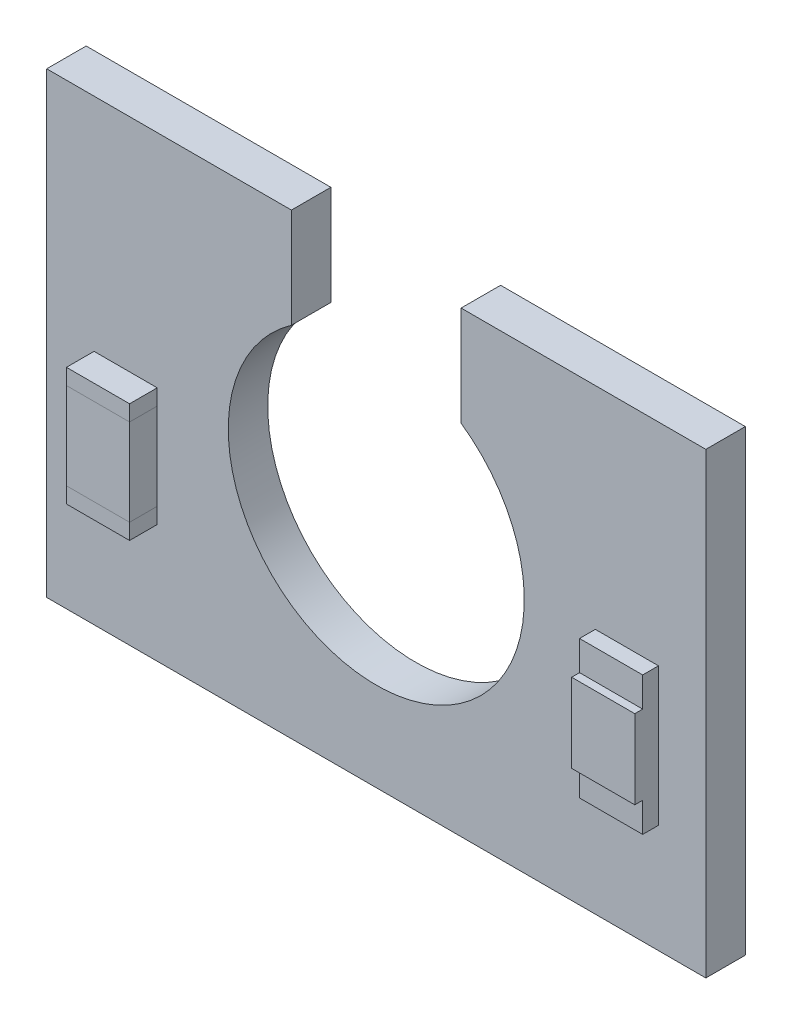
from build123d import *

# Parameters (mm, degrees)
BASES_W                           = 16.7
BASES_H                           = 11.6
BASE_DEPTH                        = 1
FASTENER_ACCESS_DEPTH             = 11.215796592
SMDCAPACITORBODYS_W               = 1.6
SMDCAPACITORBODYS_H               = 2.2
SMD_CAPACITOR_BODY_DEPTH          = 0.7
SMDCAPACITORSOLDERBODY1S_W        = 1.6
SMDCAPACITORSOLDERBODY1S_H        = 0.7
SMD_CAPACITOR_SOLDER_BODY_1_DEPTH = 0.4
SMDCAPACITORSOLDERBODY2S_W        = 1.6
SMDCAPACITORSOLDERBODY2S_H        = 0.7
SMD_CAPACITOR_SOLDER_BODY_2_DEPTH = 0.4
LEDS_W                            = 1.6
LEDS_H                            = 3.5
LED_DEPTH                         = 0.4
LEDTS_W                           = 1.6
LEDTS_H                           = 2
LED_TOP_DEPTH                     = 0.2


with BuildPart() as part:
    # BaseS → BASE (new body)
    with BuildSketch(Plane.XY):
        Rectangle(BASES_W, BASES_H)
    extrude(amount=-BASE_DEPTH)

    # FastenerAccessS → FASTENER ACCESS (cut, through all)
    with BuildSketch(Plane.XY):
        with BuildLine():
            Line((-2.15, 5.8), (2.15, 5.8))
            Line((2.15, 5.8), (2.15, 3.272458299))
            ThreePointArc((2.15, 3.272458299), (0, -3.55), (-2.15, 3.272458299))
            Line((-2.15, 3.272458299), (-2.15, 5.8))
        make_face()
    extrude(amount=-FASTENER_ACCESS_DEPTH, mode=Mode.SUBTRACT)


with BuildPart() as body_2:
    # SMDCapacitorBodyS → SMD CAPACITOR BODY (new body)
    with BuildSketch(Plane.XY):
        with Locations((-6.35, -1.3)):
            Rectangle(SMDCAPACITORBODYS_W, SMDCAPACITORBODYS_H)
    extrude(amount=SMD_CAPACITOR_BODY_DEPTH)


with BuildPart() as body_3:
    # SMDCapacitorSolderBody1S → SMD CAPACITOR SOLDER BODY 1 (new body)
    with BuildSketch(Plane.XZ.offset(2.4)):
        with Locations((-6.35, 0.35)):
            Rectangle(SMDCAPACITORSOLDERBODY1S_W, SMDCAPACITORSOLDERBODY1S_H)
    extrude(amount=SMD_CAPACITOR_SOLDER_BODY_1_DEPTH)


with BuildPart() as body_4:
    # SMDCapacitorSolderBody2S → SMD CAPACITOR SOLDER BODY 2 (new body)
    with BuildSketch(Plane(origin=(0, -0.2, 0), x_dir=(1, 0, 0), z_dir=(0, 1, 0))):
        with Locations((-6.35, -0.35)):
            Rectangle(SMDCAPACITORSOLDERBODY2S_W, SMDCAPACITORSOLDERBODY2S_H)
    extrude(amount=SMD_CAPACITOR_SOLDER_BODY_2_DEPTH)


with BuildPart() as body_5:
    # LEDS → LED (new body)
    with BuildSketch(Plane.XY):
        with Locations((6.35, -1.3)):
            Rectangle(LEDS_W, LEDS_H)
    extrude(amount=LED_DEPTH)

    # LEDTS → LED TOP (add)
    with BuildSketch(Plane.XY.offset(0.4)):
        with Locations((6.35, -1.3)):
            Rectangle(LEDTS_W, LEDTS_H)
    extrude(amount=LED_TOP_DEPTH)


solid = Compound([part.part, body_2.part, body_3.part, body_4.part, body_5.part])
